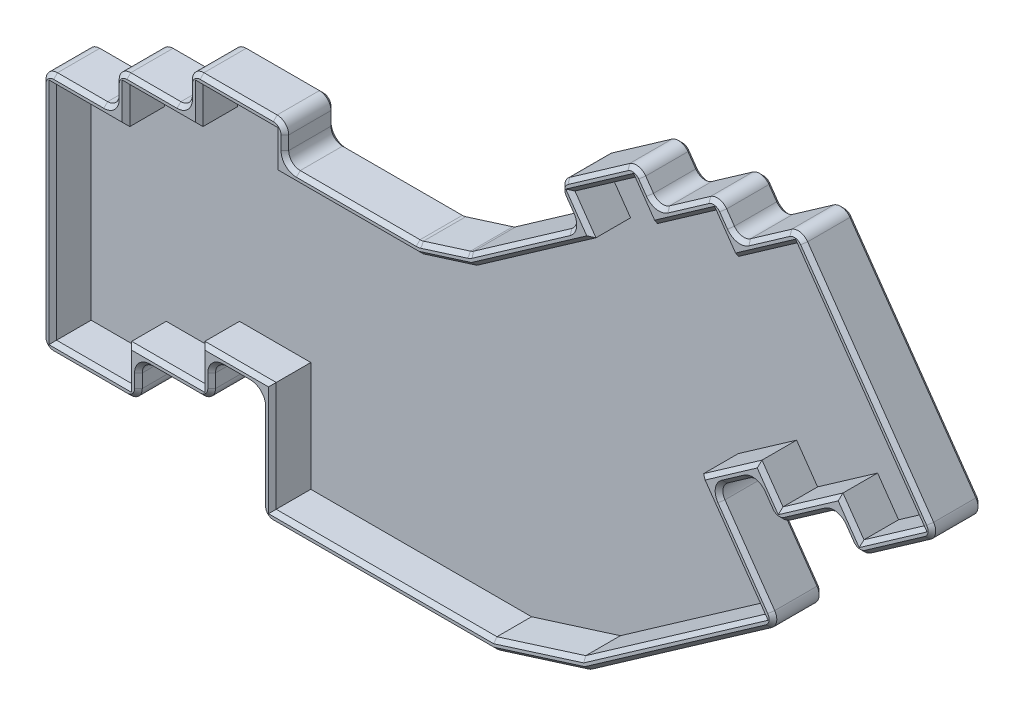
from build123d import *

# Parameters (mm, degrees)
BOSS_EXTRUDE1_DEPTH     = 3
BOSS_EXTRUDE2_START     = -3
BOSS_EXTRUDE2_DEPTH     = 13
FILLET1_R               = 3
CUT_EXTRUDE_THIN3_DEPTH = 10
CHAMFER1_SIZE           = 1


with BuildPart() as part:
    # Sketch1 → Boss-Extrude1 (new body)
    with BuildSketch(Plane.XY):
        Polygon((57.15, -66.675), (114.3, -66.675), (137.338836387, -59.41088279), (184.153375718, -26.630989453), (167.763429049, -3.223719787), (183.368275493, 7.702911326), (188.831591049, -0.099511896), (204.436437493, 10.827119216), (209.899753049, 3.024695994), (225.504599493, 13.951327107), (192.724706156, 60.765866438), (177.119859712, 49.839235325), (171.656544156, 57.641658547), (156.051697712, 46.715027435), (150.588382156, 54.517450657), (134.983535712, 43.590819544), (140.446851268, 35.788396322), (109.237158381, 13.935134097), (95.25, 9.525), (57.15, 9.525), (57.15, 19.05), (38.1, 19.05), (38.1, 9.525), (19.05, 9.525), (19.05, 0), (0, 0), (0, -57.15), (19.05, -57.15), (19.05, -47.625), (38.1, -47.625), (38.1, -38.1), (57.15, -38.1), align=None)
    extrude(amount=BOSS_EXTRUDE1_DEPTH)

    # Sketch2 → Boss-Extrude2 (add)
    with BuildSketch(Plane.XY.offset(3).offset(BOSS_EXTRUDE2_START)):
        Polygon((107.894667747, 16.657435802), (94.788255837, 12.525), (60.15, 12.525), (60.15, 22.05), (35.1, 22.05), (35.1, 12.525), (16.05, 12.525), (16.05, 3), (-3, 3), (-3, -60.15), (22.05, -60.15), (22.05, -50.625), (41.1, -50.625), (41.1, -41.1), (54.15, -41.1), (54.15, -69.675), (114.761744163, -69.675), (138.681327021, -62.133184494), (188.33156116, -27.367716276), (171.941614491, -3.960446611), (182.631548669, 3.524725884), (188.094864226, -4.277697338), (203.699710669, 6.648933774), (209.163026225, -1.153489448), (229.682784935, 13.214600283), (193.461432979, 64.94405188), (177.856586536, 54.017420767), (172.393270979, 61.819843989), (156.788424536, 50.893212877), (151.325108979, 58.695636099), (130.80535027, 44.327546368), (136.268665826, 36.525123146), align=None)
        Polygon((109.237158381, 13.935134097), (95.25, 9.525), (57.15, 9.525), (57.15, 19.05), (38.1, 19.05), (38.1, 9.525), (19.05, 9.525), (19.05, 0), (0, 0), (0, -57.15), (19.05, -57.15), (19.05, -47.625), (38.1, -47.625), (38.1, -38.1), (57.15, -38.1), (57.15, -66.675), (114.3, -66.675), (137.338836387, -59.41088279), (184.153375718, -26.630989453), (167.763429049, -3.223719787), (183.368275493, 7.702911326), (188.831591049, -0.099511896), (204.436437493, 10.827119216), (209.899753049, 3.024695994), (225.504599493, 13.951327107), (192.724706156, 60.765866438), (177.119859712, 49.839235325), (171.656544156, 57.641658547), (156.051697712, 46.715027435), (150.588382156, 54.517450657), (134.983535712, 43.590819544), (140.446851268, 35.788396322), align=None, mode=Mode.SUBTRACT)
    extrude(amount=BOSS_EXTRUDE2_DEPTH)

    # Fillet1
    fillet1_edges = [part.edges().sort_by_distance(p)[0] for p in [
        (54.15, -41.1, 6.5),
        (54.15, -69.675, 6.5),
        (114.761744163, -69.675, 6.5),
        (138.681327021, -62.133184494, 6.5),
        (188.33156116, -27.367716276, 6.5),
        (171.941614491, -3.960446611, 6.5),
        (182.631548669, 3.524725884, 6.5),
        (188.094864226, -4.277697338, 6.5),
        (203.699710669, 6.648933774, 6.5),
        (209.163026225, -1.153489448, 6.5),
        (229.682784935, 13.214600283, 6.5),
        (193.461432979, 64.94405188, 6.5),
        (177.856586536, 54.017420767, 6.5),
        (172.393270979, 61.819843989, 6.5),
        (156.788424536, 50.893212877, 6.5),
        (151.325108979, 58.695636099, 6.5),
        (130.80535027, 44.327546368, 6.5),
        (136.268665826, 36.525123146, 6.5),
        (107.894667747, 16.657435802, 6.5),
        (94.788255837, 12.525, 6.5),
        (60.15, 12.525, 6.5),
        (60.15, 22.05, 6.5),
        (35.1, 22.05, 6.5),
        (35.1, 12.525, 6.5),
        (16.05, 12.525, 6.5),
        (16.05, 3, 6.5),
        (-3, 3, 6.5),
        (-3, -60.15, 6.5),
        (22.05, -60.15, 6.5),
        (22.05, -50.625, 6.5),
        (41.1, -50.625, 6.5),
        (41.1, -41.1, 6.5),
    ]]
    fillet(fillet1_edges, radius=FILLET1_R)

    # Sketch3 → Cut-Extrude-Thin3 (cut)
    with BuildSketch(Plane.XY.offset(13)):
        Polygon((109.125284161, 14.161992573), (95.21152132, 9.775), (57.4, 9.775), (57.4, 19.3), (37.85, 19.3), (37.85, 9.775), (18.8, 9.775), (18.8, 0.25), (-0.25, 0.25), (-0.25, -57.4), (19.3, -57.4), (19.3, -47.875), (38.35, -47.875), (38.35, -38.35), (56.9, -38.35), (56.9, -66.925), (114.33847868, -66.925), (137.450710606, -59.637741265), (184.501557838, -26.692383355), (168.11161117, -3.285113689), (183.306881591, 7.354729205), (188.770197147, -0.447694017), (204.375043591, 10.478937096), (209.838359147, 2.676513874), (225.852781613, 13.889933205), (192.786100058, 61.114048558), (177.181253614, 50.187417446), (171.717938058, 57.989840667), (156.113091614, 47.063209555), (150.649776058, 54.865632777), (134.635353592, 43.652213446), (140.098669148, 35.849790224), align=None)
        Polygon((109.237158381, 13.935134097), (95.25, 9.525), (57.15, 9.525), (57.15, 19.05), (38.1, 19.05), (38.1, 9.525), (19.05, 9.525), (19.05, 0), (0, 0), (0, -57.15), (19.05, -57.15), (19.05, -47.625), (38.1, -47.625), (38.1, -38.1), (57.15, -38.1), (57.15, -66.675), (114.3, -66.675), (137.338836387, -59.41088279), (184.153375718, -26.630989453), (167.763429049, -3.223719787), (183.368275493, 7.702911326), (188.831591049, -0.099511896), (204.436437493, 10.827119216), (209.899753049, 3.024695994), (225.504599493, 13.951327107), (192.724706156, 60.765866438), (177.119859712, 49.839235325), (171.656544156, 57.641658547), (156.051697712, 46.715027435), (150.588382156, 54.517450657), (134.983535712, 43.590819544), (140.446851268, 35.788396322), align=None, mode=Mode.SUBTRACT)
    extrude(amount=-CUT_EXTRUDE_THIN3_DEPTH, mode=Mode.SUBTRACT)

    # Chamfer1
    chamfer1_edges = [part.edges().sort_by_distance(p)[0] for p in [
        (101.341461792, 14.591217901, 0),
        (101.341461792, 14.591217901, 13),
        (121.042058058, 25.863337605, 0),
        (121.042058058, 25.863337605, 13),
        (133.537008048, 40.426334757, 0),
        (133.537008048, 40.426334757, 13),
        (141.065229625, 51.511591233, 0),
        (154.056766758, 54.794424488, 0),
        (164.590847758, 56.356528433, 0),
        (175.124928758, 57.918632378, 0),
        (185.659009757, 59.480736324, 0),
        (211.572108957, 39.079326081, 0),
        (219.42290558, 6.030555418, 0),
        (206.431368447, 2.747722163, 0),
        (195.897287447, 1.185618218, 0),
        (185.363206447, -0.376485727, 0),
        (177.28658158, -0.217860364, 0),
        (180.136587826, -15.664081444, 0),
        (162.466835362, -45.478392254, 0),
        (126.721535592, -65.904092247, 0),
        (85.725, -69.675, 0),
        (54.15, -55.3875, 0),
        (47.625, -41.1, 0),
        (41.1, -45.8625, 0),
        (31.575, -50.625, 0),
        (22.05, -55.3875, 0),
        (9.525, -60.15, 0),
        (-3, -28.575, 0),
        (6.525, 3, 0),
        (16.05, 7.7625, 0),
        (25.575, 12.525, 0),
        (35.1, 17.2875, 0),
        (47.625, 22.05, 0),
        (60.15, 17.2875, 0),
        (78.738255837, 12.525, 0),
        (55.028679656, -68.796320344, 0),
        (40.221320344, -49.746320344, 0),
        (21.171320344, -59.271320344, 0),
        (-2.121320344, -59.271320344, 0),
        (-2.121320344, 2.121320344, 0),
        (16.928679656, 11.646320344, 0),
        (35.978679656, 21.171320344, 0),
        (59.271320344, 21.171320344, 0),
        (114.756370159, -69.640084531, 0),
        (138.665702458, -62.101501015, 0),
        (187.107798977, -27.151933986, 0),
        (188.310646516, -3.053935155, 0),
        (209.378808516, 0.070272735, 0),
        (228.459022752, 13.430382574, 0),
        (193.245650689, 63.720289697, 0),
        (172.177488689, 60.596081806, 0),
        (151.109326689, 57.471873916, 0),
        (132.029112453, 44.111764077, 0),
        (141.065229625, 51.511591233, 13),
        (78.738255837, 12.525, 13),
        (60.15, 17.2875, 13),
        (47.625, 22.05, 13),
        (35.1, 17.2875, 13),
        (25.575, 12.525, 13),
        (16.05, 7.7625, 13),
        (6.525, 3, 13),
        (-3, -28.575, 13),
        (9.525, -60.15, 13),
        (22.05, -55.3875, 13),
        (31.575, -50.625, 13),
        (41.1, -45.8625, 13),
        (47.625, -41.1, 13),
        (54.15, -55.3875, 13),
        (85.725, -69.675, 13),
        (126.721535592, -65.904092247, 13),
        (162.466835362, -45.478392254, 13),
        (180.136587826, -15.664081444, 13),
        (177.28658158, -0.217860364, 13),
        (185.363206447, -0.376485727, 13),
        (195.897287447, 1.185618218, 13),
        (206.431368447, 2.747722163, 13),
        (219.42290558, 6.030555418, 13),
        (211.572108957, 39.079326081, 13),
        (185.659009757, 59.480736324, 13),
        (175.124928758, 57.918632378, 13),
        (164.590847758, 56.356528433, 13),
        (154.056766758, 54.794424488, 13),
        (55.028679656, -68.796320344, 13),
        (40.221320344, -49.746320344, 13),
        (21.171320344, -59.271320344, 13),
        (-2.121320344, -59.271320344, 13),
        (-2.121320344, 2.121320344, 13),
        (16.928679656, 11.646320344, 13),
        (35.978679656, 21.171320344, 13),
        (59.271320344, 21.171320344, 13),
        (114.756370159, -69.640084531, 13),
        (138.665702458, -62.101501015, 13),
        (187.107798977, -27.151933986, 13),
        (188.310646516, -3.053935155, 13),
        (209.378808516, 0.070272735, 13),
        (228.459022752, 13.430382574, 13),
        (193.245650689, 63.720289697, 13),
        (172.177488689, 60.596081806, 13),
        (151.109326689, 57.471873916, 13),
        (132.029112453, 44.111764077, 13),
        (107.879043184, 16.689119282, 0),
        (107.879043184, 16.689119282, 13),
        (135.044903643, 36.740905437, 0),
        (135.044903643, 36.740905437, 13),
        (157.004206826, 52.11697506, 0),
        (157.004206826, 52.11697506, 13),
        (178.072368826, 55.24118295, 0),
        (178.072368826, 55.24118295, 13),
        (203.483928378, 5.425171591, 0),
        (203.483928378, 5.425171591, 13),
        (182.415766378, 2.300963701, 0),
        (182.415766378, 2.300963701, 13),
        (173.165376674, -4.176228902, 0),
        (173.165376674, -4.176228902, 13),
        (94.782881832, 12.559915469, 0),
        (94.782881832, 12.559915469, 13),
        (61.028679656, 13.403679656, 0),
        (61.028679656, 13.403679656, 13),
        (34.221320344, 13.403679656, 0),
        (34.221320344, 13.403679656, 13),
        (15.171320344, 3.878679656, 0),
        (15.171320344, 3.878679656, 13),
        (22.928679656, -51.503679656, 0),
        (22.928679656, -51.503679656, 13),
        (41.978679656, -41.978679656, 0),
        (41.978679656, -41.978679656, 13),
        (53.271320344, -41.978679656, 0),
        (53.271320344, -41.978679656, 13),
        (124.611976655, 25.005891398, 13),
        (102.16840274, 11.968496286, 13),
        (76.30576066, 9.775, 13),
        (57.4, 14.5375, 13),
        (47.625, 19.3, 13),
        (37.85, 14.5375, 13),
        (28.325, 9.775, 13),
        (18.8, 5.0125, 13),
        (9.275, 0.25, 13),
        (-0.25, -28.575, 13),
        (9.525, -57.4, 13),
        (19.3, -52.6375, 13),
        (28.825, -47.875, 13),
        (38.35, -43.1125, 13),
        (47.625, -38.35, 13),
        (56.9, -52.6375, 13),
        (85.61923934, -66.925, 13),
        (125.894594643, -63.281370633, 13),
        (160.976134222, -43.16506231, 13),
        (176.306584504, -14.988748522, 13),
        (175.70924638, 2.034807758, 13),
        (186.038539369, 3.453517594, 13),
        (196.572620369, 5.01562154, 13),
        (207.106701369, 6.577725485, 13),
        (217.84557038, 8.283223539, 13),
        (209.319440835, 37.501990881, 13),
        (184.983676836, 55.650733002, 13),
        (174.449595836, 54.088629056, 13),
        (163.915514836, 52.526525111, 13),
        (153.381433836, 50.964421166, 13),
        (142.642564825, 49.258923111, 13),
        (137.36701137, 39.751001835, 13),
    ]]
    chamfer(chamfer1_edges, length=CHAMFER1_SIZE)


solid = part.part
